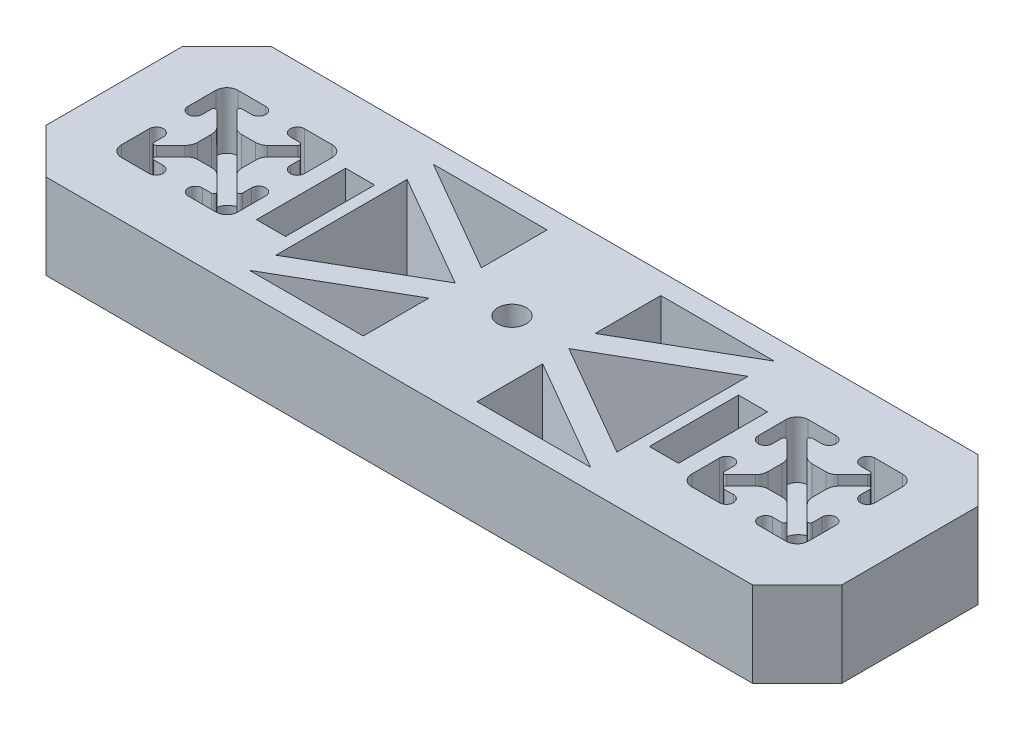
from build123d import *

# Parameters (mm, degrees)
SKETCH1_W               = 177.8
SKETCH1_H               = 50.4000008
BOSS_EXTRUDE1_DEPTH     = 6.35
SKETCH2_W               = 177.8
SKETCH2_H               = 50.4000008
BOSS_EXTRUDE2_DEPTH     = 12.7
SKETCH3_R               = 3.175
CUT_EXTRUDE1_DEPTH      = 186.784559586
CUT_EXTRUDE2_DEPTH      = 186.784559586
CHAMFER1_SIZE           = 10
SKETCH5_W               = 6.5
SKETCH5_H               = 19.9
CUT_EXTRUDE3_DEPTH      = 10.2
SKETCH6_W               = 6.5
SKETCH6_H               = 4.572
CUT_EXTRUDE4_DEPTH      = 186.086574555
CUT_EXTRUDE5_DEPTH      = 186.784559586
CUT_EXTRUDE5_DEPTH_BACK = 186.784559586
SKETCH7_R               = 3.175
CUT_EXTRUDE6_DEPTH      = 186.241167349
CUT_EXTRUDE6_DEPTH_BACK = 186.241167349
SKETCH8_R               = 3.175


with BuildPart() as part:
    # Sketch1 → Boss-Extrude1 (new body)
    with BuildSketch(Plane(origin=(0, 0, 0), x_dir=(1, 0, 0), z_dir=(0, 1, 0))):
        with Locations((88.9, 25.2000004)):
            Rectangle(SKETCH1_W, SKETCH1_H)
    extrude(amount=BOSS_EXTRUDE1_DEPTH)

    # Sketch2 → Boss-Extrude2 (add)
    with BuildSketch(Plane(origin=(0, 6.35, 0), x_dir=(1, 0, 0), z_dir=(0, 1, 0))):
        with Locations((88.9, 25.2000004)):
            Rectangle(SKETCH2_W, SKETCH2_H)
        with BuildLine():
            Line((38.207602115, 29.52001185), (38.207602115, 35.7371571))
            ThreePointArc((38.207602115, 35.7371571), (37.48390875, 37.484307436), (35.736758415, 38.2080008))
            Line((35.736758415, 38.2080008), (29.519613165, 38.2080008))
            ThreePointArc((29.519613165, 38.2080008), (27.941613165, 36.6300008), (29.519613165, 35.0520008))
            Line((29.519613165, 35.0520008), (31.618952135, 35.0520008))
            ThreePointArc((31.618952135, 35.0520008), (32.082805957, 34.741944038), (31.973665066, 34.194784253))
            Line((31.973665066, 34.194784253), (28.637609194, 30.863479703))
            ThreePointArc((28.637609194, 30.863479703), (27.774459736, 30.287408726), (26.756632806, 30.085138862))
            Line((26.756632806, 30.085138862), (23.642969309, 30.085138862))
            ThreePointArc((23.642969309, 30.085138862), (22.625142379, 30.287408726), (21.761992921, 30.863479703))
            Line((21.761992921, 30.863479703), (18.425937049, 34.194784253))
            ThreePointArc((18.425937049, 34.194784253), (18.316796158, 34.741944038), (18.78064998, 35.0520008))
            Line((18.78064998, 35.0520008), (20.87998895, 35.0520008))
            ThreePointArc((20.87998895, 35.0520008), (22.45798895, 36.6300008), (20.87998895, 38.2080008))
            Line((20.87998895, 38.2080008), (14.6628437, 38.2080008))
            ThreePointArc((14.6628437, 38.2080008), (12.915693364, 37.484307436), (12.192, 35.7371571))
            Line((12.192, 35.7371571), (12.192, 29.52001185))
            ThreePointArc((12.192, 29.52001185), (13.77, 27.94201185), (15.348, 29.52001185))
            Line((15.348, 29.52001185), (15.348, 31.596493464))
            ThreePointArc((15.348, 31.596493464), (15.657726258, 32.060210386), (16.204710632, 31.95171231))
            Line((16.204710632, 31.95171231), (19.406929995, 28.754053655))
            ThreePointArc((19.406929995, 28.754053655), (20.019806023, 27.837880259), (20.235040084, 26.756832148))
            Line((20.235040084, 26.756832148), (20.235040084, 23.643168652))
            ThreePointArc((20.235040084, 23.643168652), (20.019806023, 22.562120541), (19.406929995, 21.645947145))
            Line((19.406929995, 21.645947145), (16.204710632, 18.44828849))
            ThreePointArc((16.204710632, 18.44828849), (15.657726258, 18.339790414), (15.348, 18.803507336))
            Line((15.348, 18.803507336), (15.348, 20.87998895))
            ThreePointArc((15.348, 20.87998895), (13.77, 22.45798895), (12.192, 20.87998895))
            Line((12.192, 20.87998895), (12.192, 14.6628437))
            ThreePointArc((12.192, 14.6628437), (12.915693364, 12.915693364), (14.6628437, 12.192))
            Line((14.6628437, 12.192), (20.812064149, 12.192))
            ThreePointArc((20.812064149, 12.192), (22.390064149, 13.77), (20.812064149, 15.348))
            Line((20.812064149, 15.348), (18.78064998, 15.348))
            ThreePointArc((18.78064998, 15.348), (18.316796158, 15.658056762), (18.425937049, 16.205216547))
            Line((18.425937049, 16.205216547), (21.761992921, 19.536521097))
            ThreePointArc((21.761992921, 19.536521097), (22.625142379, 20.112592074), (23.642969309, 20.314861938))
            Line((23.642969309, 20.314861938), (26.756632806, 20.314861938))
            ThreePointArc((26.756632806, 20.314861938), (27.774459736, 20.112592074), (28.637609194, 19.536521097))
            Line((28.637609194, 19.536521097), (31.973665066, 16.205216547))
            ThreePointArc((31.973665066, 16.205216547), (32.082805957, 15.658056762), (31.618952135, 15.348))
            Line((31.618952135, 15.348), (29.587537966, 15.348))
            ThreePointArc((29.587537966, 15.348), (28.009537966, 13.77), (29.587537966, 12.192))
            Line((29.587537966, 12.192), (35.736758415, 12.192))
            ThreePointArc((35.736758415, 12.192), (37.48390875, 12.915693364), (38.207602115, 14.6628437))
            Line((38.207602115, 14.6628437), (38.207602115, 20.87998895))
            ThreePointArc((38.207602115, 20.87998895), (36.629602115, 22.45798895), (35.051602115, 20.87998895))
            Line((35.051602115, 20.87998895), (35.051602115, 18.803507336))
            ThreePointArc((35.051602115, 18.803507336), (34.741875857, 18.339790414), (34.194891482, 18.44828849))
            Line((34.194891482, 18.44828849), (30.99267212, 21.645947145))
            ThreePointArc((30.99267212, 21.645947145), (30.379796092, 22.562120541), (30.16456203, 23.643168652))
            Line((30.16456203, 23.643168652), (30.16456203, 26.756832148))
            ThreePointArc((30.16456203, 26.756832148), (30.379796092, 27.837880259), (30.99267212, 28.754053655))
            Line((30.99267212, 28.754053655), (34.194891482, 31.95171231))
            ThreePointArc((34.194891482, 31.95171231), (34.741875857, 32.060210386), (35.051602115, 31.596493464))
            Line((35.051602115, 31.596493464), (35.051602115, 29.52001185))
            ThreePointArc((35.051602115, 29.52001185), (36.629602115, 27.94201185), (38.207602115, 29.52001185))
        make_face(mode=Mode.SUBTRACT)
        with BuildLine():
            Line((142.748397885, 31.596493464), (142.748397885, 29.52001185))
            ThreePointArc((142.748397885, 29.52001185), (141.170397885, 27.94201185), (139.592397885, 29.52001185))
            Line((139.592397885, 29.52001185), (139.592397885, 35.7371571))
            ThreePointArc((139.592397885, 35.7371571), (140.31609125, 37.484307436), (142.063241585, 38.2080008))
            Line((142.063241585, 38.2080008), (148.280386835, 38.2080008))
            ThreePointArc((148.280386835, 38.2080008), (149.858386835, 36.6300008), (148.280386835, 35.0520008))
            Line((148.280386835, 35.0520008), (146.181047865, 35.0520008))
            ThreePointArc((146.181047865, 35.0520008), (145.717194043, 34.741944038), (145.826334934, 34.194784253))
            Line((145.826334934, 34.194784253), (149.162390806, 30.863479703))
            ThreePointArc((149.162390806, 30.863479703), (150.025540264, 30.287408726), (151.043367194, 30.085138862))
            Line((151.043367194, 30.085138862), (154.157030691, 30.085138862))
            ThreePointArc((154.157030691, 30.085138862), (155.174857621, 30.287408726), (156.038007079, 30.863479703))
            Line((156.038007079, 30.863479703), (159.374062951, 34.194784253))
            ThreePointArc((159.374062951, 34.194784253), (159.483203842, 34.741944038), (159.01935002, 35.0520008))
            Line((159.01935002, 35.0520008), (156.92001105, 35.0520008))
            ThreePointArc((156.92001105, 35.0520008), (155.34201105, 36.6300008), (156.92001105, 38.2080008))
            Line((156.92001105, 38.2080008), (163.1371563, 38.2080008))
            ThreePointArc((163.1371563, 38.2080008), (164.884306636, 37.484307436), (165.608, 35.7371571))
            Line((165.608, 35.7371571), (165.608, 29.52001185))
            ThreePointArc((165.608, 29.52001185), (164.03, 27.94201185), (162.452, 29.52001185))
            Line((162.452, 29.52001185), (162.452, 31.596493464))
            ThreePointArc((162.452, 31.596493464), (162.142273742, 32.060210386), (161.595289368, 31.95171231))
            Line((161.595289368, 31.95171231), (158.393070005, 28.754053655))
            ThreePointArc((158.393070005, 28.754053655), (157.780193977, 27.837880259), (157.564959916, 26.756832148))
            Line((157.564959916, 26.756832148), (157.564959916, 23.643168652))
            ThreePointArc((157.564959916, 23.643168652), (157.780193977, 22.562120541), (158.393070005, 21.645947145))
            Line((158.393070005, 21.645947145), (161.595289368, 18.44828849))
            ThreePointArc((161.595289368, 18.44828849), (162.142273742, 18.339790414), (162.452, 18.803507336))
            Line((162.452, 18.803507336), (162.452, 20.87998895))
            ThreePointArc((162.452, 20.87998895), (164.03, 22.45798895), (165.608, 20.87998895))
            Line((165.608, 20.87998895), (165.608, 14.6628437))
            ThreePointArc((165.608, 14.6628437), (164.884306636, 12.915693364), (163.1371563, 12.192))
            Line((163.1371563, 12.192), (156.987935851, 12.192))
            ThreePointArc((156.987935851, 12.192), (155.409935851, 13.77), (156.987935851, 15.348))
            Line((156.987935851, 15.348), (159.01935002, 15.348))
            ThreePointArc((159.01935002, 15.348), (159.483203842, 15.658056762), (159.374062951, 16.205216547))
            Line((159.374062951, 16.205216547), (156.038007079, 19.536521097))
            ThreePointArc((156.038007079, 19.536521097), (155.174857621, 20.112592074), (154.157030691, 20.314861938))
            Line((154.157030691, 20.314861938), (151.043367194, 20.314861938))
            ThreePointArc((151.043367194, 20.314861938), (150.025540264, 20.112592074), (149.162390806, 19.536521097))
            Line((149.162390806, 19.536521097), (145.826334934, 16.205216547))
            ThreePointArc((145.826334934, 16.205216547), (145.717194043, 15.658056762), (146.181047865, 15.348))
            Line((146.181047865, 15.348), (148.212462034, 15.348))
            ThreePointArc((148.212462034, 15.348), (149.790462034, 13.77), (148.212462034, 12.192))
            Line((148.212462034, 12.192), (142.063241585, 12.192))
            ThreePointArc((142.063241585, 12.192), (140.31609125, 12.915693364), (139.592397885, 14.6628437))
            Line((139.592397885, 14.6628437), (139.592397885, 20.87998895))
            ThreePointArc((139.592397885, 20.87998895), (141.170397885, 22.45798895), (142.748397885, 20.87998895))
            Line((142.748397885, 20.87998895), (142.748397885, 18.803507336))
            ThreePointArc((142.748397885, 18.803507336), (143.058124143, 18.339790414), (143.605108518, 18.44828849))
            Line((143.605108518, 18.44828849), (146.80732788, 21.645947145))
            ThreePointArc((146.80732788, 21.645947145), (147.420203908, 22.562120541), (147.63543797, 23.643168652))
            Line((147.63543797, 23.643168652), (147.63543797, 26.756832148))
            ThreePointArc((147.63543797, 26.756832148), (147.420203908, 27.837880259), (146.80732788, 28.754053655))
            Line((146.80732788, 28.754053655), (143.605108518, 31.95171231))
            ThreePointArc((143.605108518, 31.95171231), (143.058124143, 32.060210386), (142.748397885, 31.596493464))
        make_face(mode=Mode.SUBTRACT)
    extrude(amount=BOSS_EXTRUDE2_DEPTH)

    # Sketch3 → Cut-Extrude1 (cut, through all)
    with BuildSketch(Plane(origin=(0, 19.05, 0), x_dir=(1, 0, 0), z_dir=(0, 1, 0))):
        with Locations(Location((88.9, 25.2000004, 0), (0, 0, 270))):
            Circle(SKETCH3_R)
    extrude(amount=-CUT_EXTRUDE1_DEPTH, mode=Mode.SUBTRACT)

    # Sketch4 → Cut-Extrude2 (cut, through all)
    with BuildSketch(Plane(origin=(0, 19.05, 0), x_dir=(1, 0, 0), z_dir=(0, 1, 0))):
        Polygon((50.8, 45.730575972), (76.2, 45.730575972), (76.2, 31.065879135), align=None)
        Polygon((76.2, 19.334121665), (76.2, 4.669424828), (50.8, 4.669424828), align=None)
        Polygon((50.8, 39.864697237), (50.8, 10.535303563), (76.2, 25.2000004), align=None)
        Polygon((101.6, 25.2000004), (127, 39.864697237), (127, 10.535303563), align=None)
        Polygon((127, 4.669424828), (101.6, 19.334121665), (101.6, 4.669424828), align=None)
        Polygon((101.6, 31.065879135), (127, 45.730575972), (101.6, 45.730575972), align=None)
    extrude(amount=-CUT_EXTRUDE2_DEPTH, mode=Mode.SUBTRACT)

    # Chamfer1
    chamfer1_edges = [part.edges().sort_by_distance(p)[0] for p in [
        (0, 9.525, -50.4000008),
        (177.8, 9.525, -50.4000008),
        (177.8, 9.525, 0),
        (0, 9.525, 0),
    ]]
    chamfer(chamfer1_edges, length=CHAMFER1_SIZE)

    # Sketch5 → Cut-Extrude3 (cut)
    with BuildSketch(Plane(origin=(0, 19.05, 0), x_dir=(1, 0, 0), z_dir=(0, 1, 0))):
        with Locations((45.013602115, 25.2000004)):
            Rectangle(SKETCH5_W, SKETCH5_H)
    cut_extrude3 = extrude(amount=-CUT_EXTRUDE3_DEPTH, mode=Mode.SUBTRACT)

    # Sketch6 → Cut-Extrude4 (cut, through all)
    with BuildSketch(Plane(origin=(0, 8.85, 0), x_dir=(1, 0, 0), z_dir=(0, 1, 0))):
        with Locations((45.013602115, 32.8640004)):
            Rectangle(SKETCH6_W, SKETCH6_H)
        with Locations((45.013602115, 25.2000004)):
            Rectangle(SKETCH6_W, SKETCH6_H)
        with Locations((45.013602115, 17.5360004)):
            Rectangle(SKETCH6_W, SKETCH6_H)
    cut_extrude4 = extrude(amount=-CUT_EXTRUDE4_DEPTH, mode=Mode.SUBTRACT)

    # Mirror1: Cut-Extrude3, Cut-Extrude4 across plane
    add(cut_extrude3.mirror(Plane.ZY.offset(-88.9)), mode=Mode.SUBTRACT)
    add(cut_extrude4.mirror(Plane.ZY.offset(-88.9)), mode=Mode.SUBTRACT)

    # Sketch7 → Cut-Extrude5 (cut, two sides: drawn at the far end of the back side and taken through both)
    with BuildSketch(Plane(origin=(0, 19.05, 0), x_dir=(1, 0, 0), z_dir=(0, 1, 0)).offset(-CUT_EXTRUDE5_DEPTH_BACK)):
        with Locations(Location((25.33856203, 25.259138862, 0), (0, 0, 270))):
            Circle(SKETCH7_R)
    extrude(amount=CUT_EXTRUDE5_DEPTH + CUT_EXTRUDE5_DEPTH_BACK, mode=Mode.SUBTRACT)

    # Sketch8 → Cut-Extrude6 (cut, two sides: drawn at the far end of the back side and taken through both)
    with BuildSketch(Plane(origin=(0, 6.35, 0), x_dir=(1, 0, 0), z_dir=(0, 1, 0)).offset(-CUT_EXTRUDE6_DEPTH_BACK)):
        with Locations(Location((152.738959916, 25.259138862, 0), (0, 0, 270))):
            Circle(SKETCH8_R)
    extrude(amount=CUT_EXTRUDE6_DEPTH + CUT_EXTRUDE6_DEPTH_BACK, mode=Mode.SUBTRACT)


solid = part.part
